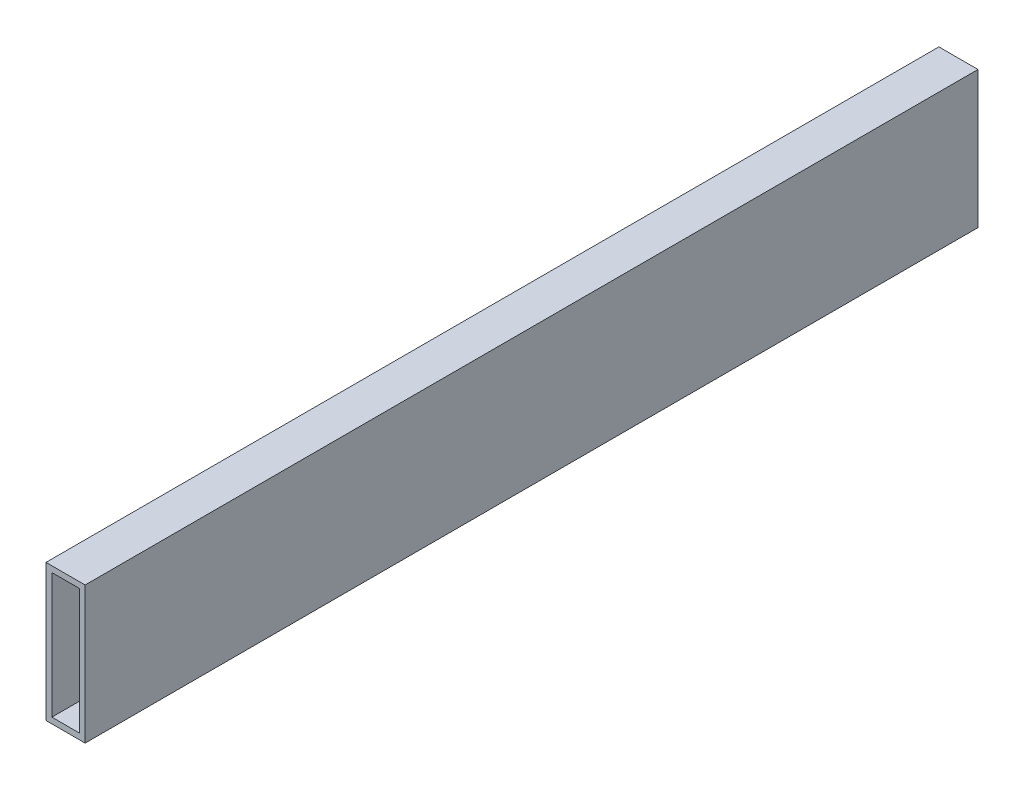
from build123d import *

# Parameters (mm, degrees)
SKETCH1_W           = 3
SKETCH1_H           = 64
SKETCH1_H_2         = 3
SKETCH1_W_2         = 14
BOSS_EXTRUDE1_DEPTH = 50
SKETCH2_W           = 20
SKETCH2_H           = 70
SKETCH2_W_2         = 14
SKETCH2_H_2         = 64
BOSS_EXTRUDE2_DEPTH = 406.293714059


with BuildPart() as part:
    # Sketch1 → Boss-Extrude1 (new body)
    with BuildSketch(Plane.XY):
        with Locations((1.5, 35)):
            Rectangle(SKETCH1_W, SKETCH1_H)
        with Locations((1.5, 68.5)):
            Rectangle(SKETCH1_W, SKETCH1_H_2)
        with Locations((10, 68.5)):
            Rectangle(SKETCH1_W_2, SKETCH1_H_2)
        with Locations((18.5, 68.5)):
            Rectangle(SKETCH1_W, SKETCH1_H_2)
        with Locations((18.5, 35)):
            Rectangle(SKETCH1_W, SKETCH1_H)
        with Locations((10, 1.5)):
            Rectangle(SKETCH1_W_2, SKETCH1_H_2)
        with Locations((1.5, 1.5)):
            Rectangle(SKETCH1_W, SKETCH1_H_2)
        with Locations((18.5, 1.5)):
            Rectangle(SKETCH1_W, SKETCH1_H_2)
    extrude(amount=-BOSS_EXTRUDE1_DEPTH)

    # Sketch2 → Boss-Extrude2 (add)
    with BuildSketch(Plane.XY):
        with Locations((10, 35)):
            Rectangle(SKETCH2_W, SKETCH2_H)
        with Locations((10, 35)):
            Rectangle(SKETCH2_W_2, SKETCH2_H_2, mode=Mode.SUBTRACT)
    extrude(amount=BOSS_EXTRUDE2_DEPTH)


solid = part.part
